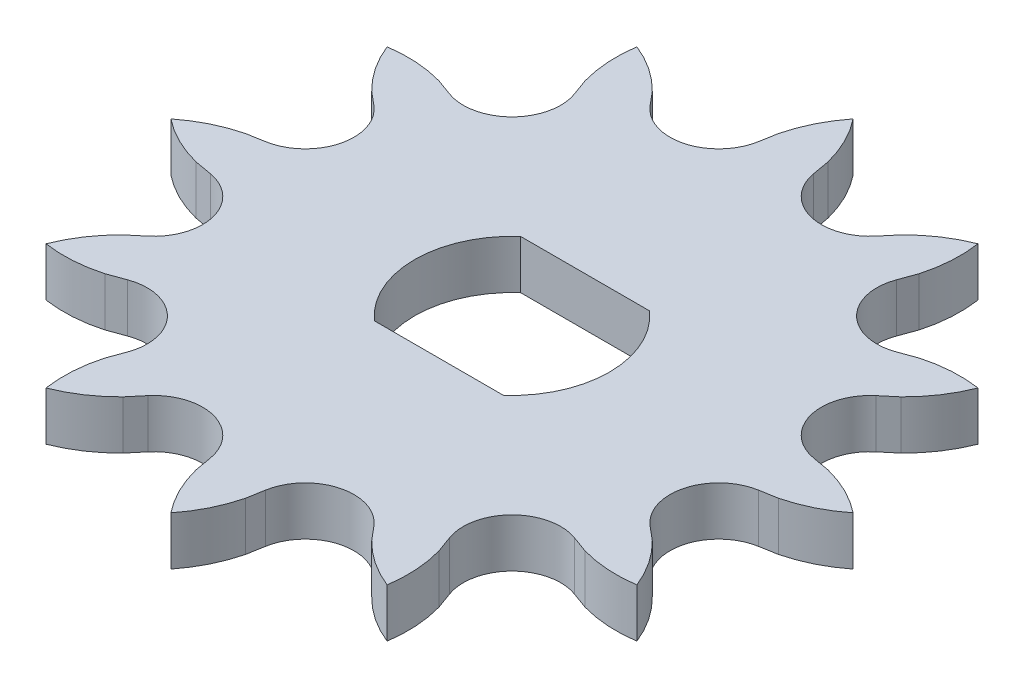
from build123d import *

# Parameters (mm, degrees)
SKETCH1_R           = 10
BOSS_EXTRUDE3_DEPTH = 2
CUT_EXTRUDE4_START  = -2
CUT_EXTRUDE4_DEPTH  = 2
CUT_EXTRUDE5_DEPTH  = 2
CUT_EXTRUDE7_START  = -2
CUT_EXTRUDE7_DEPTH  = 2


with BuildPart() as part:
    # Sketch1 → Boss-Extrude3 (new body)
    # profile 1 of 3: a face of its own
    with BuildSketch(Plane(origin=(0, 0, 0), x_dir=(1, 0, 0), z_dir=(0, 1, 0))):
        with BuildLine():
            ThreePointArc((-2.576546391, 9.66237076), (-3.696714803, 9.688501423), (-4.6270391, 10.312966622))
            Line((-4.6270391, 10.312966622), (-5.089759275, 10.867122458))
            add(Edge.make_bspline(
                [(-5.089759275, 10.867122458), (-6.64901802, 12.325915574), (-6.970753087, 12.141194398)],
                knots=[0, 0, 0, 1, 1, 1], degree=2, weights=[1, 1.687053572, 1]))
            ThreePointArc((-6.970753087, 12.141194398), (-7.014608214, -12.115909855), (14, 0))
            ThreePointArc((14, 0), (9.899494937, 9.899494937), (0, 14))
            add(Edge.make_bspline(
                [(-0.996876474, 11.958521535), (-0.370992408, 14), (0, 14)],
                knots=[0, 0, 0, 1, 1, 1], degree=2, weights=[1, 1.687053572, 1]))
            Line((-0.996876474, 11.958521535), (-1.122240194, 11.247548548))
            ThreePointArc((-1.122240194, 11.247548548), (-1.618115564, 10.242776114), (-2.576546391, 9.66237076))
        make_face()
        with BuildLine():
            ThreePointArc((10, 0), (-6.092394278, -7.9298633), (-2.576546391, 9.66237076))
            ThreePointArc((-2.576546391, 9.66237076), (6.092394278, 7.9298633), (10, 0))
        make_face(mode=Mode.SUBTRACT)
    # profile 2 of 3: a face of its own
    with BuildSketch(Plane(origin=(0, 0, 0), x_dir=(1, 0, 0), z_dir=(0, 1, 0))):
        Circle(SKETCH1_R)
    # profile 3 of 3: a face of its own
    with BuildSketch(Plane(origin=(0, 0, 0), x_dir=(1, 0, 0), z_dir=(0, 1, 0))):
        with BuildLine():
            Line((-5.089759275, 10.867122458), (-4.6270391, 10.312966622))
            ThreePointArc((-4.6270391, 10.312966622), (-3.696714803, 9.688501423), (-2.576546391, 9.66237076))
            ThreePointArc((-2.576546391, 9.66237076), (-1.618115564, 10.242776114), (-1.122240194, 11.247548548))
            Line((-1.122240194, 11.247548548), (-0.996876474, 11.958521535))
            add(Edge.make_bspline(
                [(-0.996876474, 11.958521535), (-0.370992408, 14), (0, 14)],
                knots=[0, 0, 0, 1, 1, 1], degree=2, weights=[1, 1.687053572, 1]))
            ThreePointArc((0, 14), (-3.607164983, 13.527319054), (-6.970753087, 12.141194398))
            add(Edge.make_bspline(
                [(-5.089759275, 10.867122458), (-6.64901802, 12.325915574), (-6.970753087, 12.141194398)],
                knots=[0, 0, 0, 1, 1, 1], degree=2, weights=[1, 1.687053572, 1]))
        make_face()
    extrude(amount=BOSS_EXTRUDE3_DEPTH)

    # Sketch2 → Cut-Extrude4 (cut)
    with BuildSketch(Plane(origin=(0, 2, 0), x_dir=(1, 0, 0), z_dir=(0, 1, 0)).offset(CUT_EXTRUDE4_START)):
        with BuildLine():
            Line((-1.136213035, 11.24381356), (-1.010390736, 11.95738728))
            ThreePointArc((-1.010390736, 11.95738728), (-0.613638742, 13.032335811), (0, 14))
            ThreePointArc((0, 14), (-3.623466631, 13.522961568), (-7, 12.124355653))
            ThreePointArc((-7, 12.124355653), (-5.984741166, 11.593153253), (-5.103669595, 10.860596515))
            Line((-5.103669595, 10.860596515), (-4.637917427, 10.305534696))
            ThreePointArc((-4.637917427, 10.305534696), (-2.588190451, 9.659258263), (-1.136213035, 11.24381356))
        make_face()
    extrude(amount=CUT_EXTRUDE4_DEPTH, mode=Mode.SUBTRACT)

    # Sketch3 → Cut-Extrude5 (cut)
    with BuildSketch(Plane(origin=(0, 2, 0), x_dir=(1, 0, 0), z_dir=(0, 1, 0))):
        with BuildLine():
            Line((-2.645751311, 3), (2.645751311, 3))
            ThreePointArc((2.645751311, 3), (4, 0), (2.645751311, -3))
            Line((2.645751311, -3), (-2.645751311, -3))
            ThreePointArc((-2.645751311, -3), (-4, 0), (-2.645751311, 3))
        make_face()
    extrude(amount=-CUT_EXTRUDE5_DEPTH, mode=Mode.SUBTRACT)

    # Sketch2<5> → Cut-Extrude7 (cut)
    with BuildSketch(Plane(origin=(0, 2, 0), x_dir=(1, 0, 0), z_dir=(0, 1, 0)).offset(CUT_EXTRUDE7_START)):
        with BuildLine():
            ThreePointArc((7, 12.124355653), (3.623466631, 13.522961568), (0, 14))
            ThreePointArc((0, 14), (0.613638742, 13.032335811), (1.010390736, 11.95738728))
            Line((1.010390736, 11.95738728), (1.136213035, 11.24381356))
            ThreePointArc((1.136213035, 11.24381356), (2.588190451, 9.659258263), (4.637917427, 10.305534696))
            Line((4.637917427, 10.305534696), (5.103669595, 10.860596515))
            ThreePointArc((5.103669595, 10.860596515), (5.984741166, 11.593153253), (7, 12.124355653))
        make_face()
        with BuildLine():
            ThreePointArc((12.124355653, 7), (9.899494937, 9.899494937), (7, 12.124355653))
            ThreePointArc((7, 12.124355653), (7.047594644, 10.979514512), (6.853717685, 9.850205779))
            Line((6.853717685, 9.850205779), (6.605896133, 9.169321661))
            ThreePointArc((6.605896133, 9.169321661), (7.071067812, 7.071067812), (9.169321661, 6.605896133))
            Line((9.169321661, 6.605896133), (9.850205779, 6.853717685))
            ThreePointArc((9.850205779, 6.853717685), (10.979514512, 7.047594644), (12.124355653, 7))
        make_face()
        with BuildLine():
            ThreePointArc((14, 0), (13.522961568, 3.623466631), (12.124355653, 7))
            ThreePointArc((12.124355653, 7), (11.593153253, 5.984741166), (10.860596515, 5.103669595))
            Line((10.860596515, 5.103669595), (10.305534696, 4.637917427))
            ThreePointArc((10.305534696, 4.637917427), (9.659258263, 2.588190451), (11.24381356, 1.136213035))
            Line((11.24381356, 1.136213035), (11.95738728, 1.010390736))
            ThreePointArc((11.95738728, 1.010390736), (13.032335811, 0.613638742), (14, 0))
        make_face()
        with BuildLine():
            ThreePointArc((-6.853717685, 9.850205779), (-7.047594644, 10.979514512), (-7, 12.124355653))
            ThreePointArc((-7, 12.124355653), (-9.899494937, 9.899494937), (-12.124355653, 7))
            ThreePointArc((-12.124355653, 7), (-10.979514512, 7.047594644), (-9.850205779, 6.853717685))
            Line((-9.850205779, 6.853717685), (-9.169321661, 6.605896133))
            ThreePointArc((-9.169321661, 6.605896133), (-7.071067812, 7.071067812), (-6.605896133, 9.169321661))
            Line((-6.605896133, 9.169321661), (-6.853717685, 9.850205779))
        make_face()
        with BuildLine():
            ThreePointArc((12.124355653, -7), (13.522961568, -3.623466631), (14, 0))
            ThreePointArc((14, 0), (13.032335811, -0.613638742), (11.95738728, -1.010390736))
            Line((11.95738728, -1.010390736), (11.24381356, -1.136213035))
            ThreePointArc((11.24381356, -1.136213035), (9.659258263, -2.588190451), (10.305534696, -4.637917427))
            Line((10.305534696, -4.637917427), (10.860596515, -5.103669595))
            ThreePointArc((10.860596515, -5.103669595), (11.593153253, -5.984741166), (12.124355653, -7))
        make_face()
        with BuildLine():
            ThreePointArc((-10.860596515, 5.103669595), (-11.593153253, 5.984741166), (-12.124355653, 7))
            ThreePointArc((-12.124355653, 7), (-13.522961568, 3.623466631), (-14, 0))
            ThreePointArc((-14, 0), (-13.032335811, 0.613638742), (-11.95738728, 1.010390736))
            Line((-11.95738728, 1.010390736), (-11.24381356, 1.136213035))
            ThreePointArc((-11.24381356, 1.136213035), (-9.659258263, 2.588190451), (-10.305534696, 4.637917427))
            Line((-10.305534696, 4.637917427), (-10.860596515, 5.103669595))
        make_face()
        with BuildLine():
            ThreePointArc((7, -12.124355653), (9.899494937, -9.899494937), (12.124355653, -7))
            ThreePointArc((12.124355653, -7), (10.979514512, -7.047594644), (9.850205779, -6.853717685))
            Line((9.850205779, -6.853717685), (9.169321661, -6.605896133))
            ThreePointArc((9.169321661, -6.605896133), (7.071067812, -7.071067812), (6.605896133, -9.169321661))
            Line((6.605896133, -9.169321661), (6.853717685, -9.850205779))
            ThreePointArc((6.853717685, -9.850205779), (7.047594644, -10.979514512), (7, -12.124355653))
        make_face()
        with BuildLine():
            ThreePointArc((-11.95738728, -1.010390736), (-13.032335811, -0.613638742), (-14, 0))
            ThreePointArc((-14, 0), (-13.522961568, -3.623466631), (-12.124355653, -7))
            ThreePointArc((-12.124355653, -7), (-11.593153253, -5.984741166), (-10.860596515, -5.103669595))
            Line((-10.860596515, -5.103669595), (-10.305534696, -4.637917427))
            ThreePointArc((-10.305534696, -4.637917427), (-9.659258263, -2.588190451), (-11.24381356, -1.136213035))
            Line((-11.24381356, -1.136213035), (-11.95738728, -1.010390736))
        make_face()
        with BuildLine():
            ThreePointArc((0, -14), (3.623466631, -13.522961568), (7, -12.124355653))
            ThreePointArc((7, -12.124355653), (5.984741166, -11.593153253), (5.103669595, -10.860596515))
            Line((5.103669595, -10.860596515), (4.637917427, -10.305534696))
            ThreePointArc((4.637917427, -10.305534696), (2.588190451, -9.659258263), (1.136213035, -11.24381356))
            Line((1.136213035, -11.24381356), (1.010390736, -11.95738728))
            ThreePointArc((1.010390736, -11.95738728), (0.613638742, -13.032335811), (0, -14))
        make_face()
        with BuildLine():
            ThreePointArc((-9.850205779, -6.853717685), (-10.979514512, -7.047594644), (-12.124355653, -7))
            ThreePointArc((-12.124355653, -7), (-9.899494937, -9.899494937), (-7, -12.124355653))
            ThreePointArc((-7, -12.124355653), (-7.047594644, -10.979514512), (-6.853717685, -9.850205779))
            Line((-6.853717685, -9.850205779), (-6.605896133, -9.169321661))
            ThreePointArc((-6.605896133, -9.169321661), (-7.071067812, -7.071067812), (-9.169321661, -6.605896133))
            Line((-9.169321661, -6.605896133), (-9.850205779, -6.853717685))
        make_face()
        with BuildLine():
            ThreePointArc((-7, -12.124355653), (-3.623466631, -13.522961568), (0, -14))
            ThreePointArc((0, -14), (-0.613638742, -13.032335811), (-1.010390736, -11.95738728))
            Line((-1.010390736, -11.95738728), (-1.136213035, -11.24381356))
            ThreePointArc((-1.136213035, -11.24381356), (-2.588190451, -9.659258263), (-4.637917427, -10.305534696))
            Line((-4.637917427, -10.305534696), (-5.103669595, -10.860596515))
            ThreePointArc((-5.103669595, -10.860596515), (-5.984741166, -11.593153253), (-7, -12.124355653))
        make_face()
    extrude(amount=CUT_EXTRUDE7_DEPTH, mode=Mode.SUBTRACT)


solid = part.part
